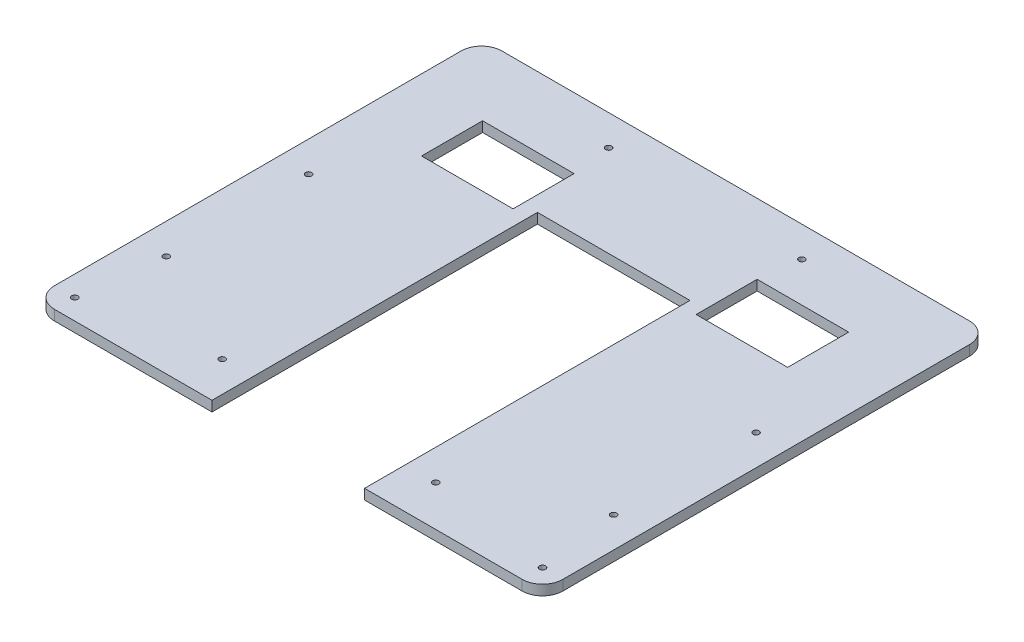
from build123d import *

# Parameters (mm, degrees)
EXTRUDE_1_DEPTH     = 5
SKETCH_4_W          = 45
SKETCH_4_H          = 30
CUT_EXTRUDE_3_DEPTH = 5
SKETCH_5_W          = 75
SKETCH_5_H          = 160
CUT_EXTRUDE_4_DEPTH = 5
CUT_EXTRUDE_5_REACH = 335.054
SKETCH_6_R          = 1.5
CUT_EXTRUDE_8_REACH = 335.054
SKETCH_8_R          = 1.5
CUT_EXTRUDE_9_REACH = 335.054
SKETCH_9_R          = 1.5


with BuildPart() as part:
    # 草图1 → 凸台-拉伸1 (new body)
    with BuildSketch(Plane(origin=(0, 0, 0), x_dir=(1, 0, 0), z_dir=(0, 1, 0))):
        with BuildLine():
            Line((10, 0), (240, 0))
            ThreePointArc((240, 0), (247.071067812, -2.928932188), (250, -10))
            Line((250, -10), (250, -210))
            ThreePointArc((250, -210), (247.071067812, -217.071067812), (240, -220))
            Line((240, -220), (10, -220))
            ThreePointArc((10, -220), (2.928932188, -217.071067812), (0, -210))
            Line((0, -210), (0, -10))
            ThreePointArc((0, -10), (2.928932188, -2.928932188), (10, 0))
        make_face()
    extrude(amount=EXTRUDE_1_DEPTH)

    # 草图4 → 切除-拉伸3 (cut)
    with BuildSketch(Plane.XZ):
        with Locations((192.5, 49.475)):
            Rectangle(SKETCH_4_W, SKETCH_4_H)
        with Locations((57.5, 49.475)):
            Rectangle(SKETCH_4_W, SKETCH_4_H)
    extrude(amount=-CUT_EXTRUDE_3_DEPTH, mode=Mode.SUBTRACT)

    # 草图5 → 切除-拉伸4 (cut)
    with BuildSketch(Plane.XZ):
        with Locations((125, 140)):
            Rectangle(SKETCH_5_W, SKETCH_5_H)
    extrude(amount=-CUT_EXTRUDE_4_DEPTH, mode=Mode.SUBTRACT)

    # 草图6 → 切除-拉伸5 (cut, up to next)
    with BuildSketch(Plane.XZ, mode=Mode.PRIVATE) as cut_extrude_5_sk1:
        with Locations(Location((72.5, 200, 0), (0, 0, 270))):
            Circle(SKETCH_6_R)
    cut_extrude_5_tool1 = extrude(cut_extrude_5_sk1.sketch, amount=-CUT_EXTRUDE_5_REACH, mode=Mode.PRIVATE) & part.part
    # 草图6 → 切除-拉伸5 (cut, up to next)
    with BuildSketch(Plane.XZ, mode=Mode.PRIVATE) as cut_extrude_5_sk2:
        with Locations(Location((177.5, 200, 0), (0, 0, 90))):
            Circle(SKETCH_6_R)
    cut_extrude_5_tool2 = extrude(cut_extrude_5_sk2.sketch, amount=-CUT_EXTRUDE_5_REACH, mode=Mode.PRIVATE) & part.part
    add(cut_extrude_5_tool1.solids().sort_by_distance((72.5, 0, 200))[0], mode=Mode.SUBTRACT)
    add(cut_extrude_5_tool2.solids().sort_by_distance((177.5, 0, 200))[0], mode=Mode.SUBTRACT)

    # 草图8 → 切除-拉伸8 (cut, up to next)
    with BuildSketch(Plane.XZ, mode=Mode.PRIVATE) as cut_extrude_8_sk1:
        with Locations(Location((235, 170, 0), (0, 0, 270))):
            Circle(SKETCH_8_R)
    cut_extrude_8_tool1 = extrude(cut_extrude_8_sk1.sketch, amount=-CUT_EXTRUDE_8_REACH, mode=Mode.PRIVATE) & part.part
    # 草图8 → 切除-拉伸8 (cut, up to next)
    with BuildSketch(Plane.XZ, mode=Mode.PRIVATE) as cut_extrude_8_sk2:
        with Locations(Location((235, 100, 0), (0, 0, 270))):
            Circle(SKETCH_8_R)
    cut_extrude_8_tool2 = extrude(cut_extrude_8_sk2.sketch, amount=-CUT_EXTRUDE_8_REACH, mode=Mode.PRIVATE) & part.part
    # 草图8 → 切除-拉伸8 (cut, up to next)
    with BuildSketch(Plane.XZ, mode=Mode.PRIVATE) as cut_extrude_8_sk3:
        with Locations(Location((15, 100, 0), (0, 0, 90))):
            Circle(SKETCH_8_R)
    cut_extrude_8_tool3 = extrude(cut_extrude_8_sk3.sketch, amount=-CUT_EXTRUDE_8_REACH, mode=Mode.PRIVATE) & part.part
    # 草图8 → 切除-拉伸8 (cut, up to next)
    with BuildSketch(Plane.XZ, mode=Mode.PRIVATE) as cut_extrude_8_sk4:
        with Locations(Location((15, 170, 0), (0, 0, 90))):
            Circle(SKETCH_8_R)
    cut_extrude_8_tool4 = extrude(cut_extrude_8_sk4.sketch, amount=-CUT_EXTRUDE_8_REACH, mode=Mode.PRIVATE) & part.part
    add(cut_extrude_8_tool1.solids().sort_by_distance((235, 0, 170))[0], mode=Mode.SUBTRACT)
    add(cut_extrude_8_tool2.solids().sort_by_distance((235, 0, 100))[0], mode=Mode.SUBTRACT)
    add(cut_extrude_8_tool3.solids().sort_by_distance((15, 0, 100))[0], mode=Mode.SUBTRACT)
    add(cut_extrude_8_tool4.solids().sort_by_distance((15, 0, 170))[0], mode=Mode.SUBTRACT)

    # 草图9 → 切除-拉伸9 (cut, up to next)
    with BuildSketch(Plane.XZ, mode=Mode.PRIVATE) as cut_extrude_9_sk1:
        with Locations(Location((77.5, 15, 0), (0, 0, 270))):
            Circle(SKETCH_9_R)
    cut_extrude_9_tool1 = extrude(cut_extrude_9_sk1.sketch, amount=-CUT_EXTRUDE_9_REACH, mode=Mode.PRIVATE) & part.part
    # 草图9 → 切除-拉伸9 (cut, up to next)
    with BuildSketch(Plane.XZ, mode=Mode.PRIVATE) as cut_extrude_9_sk2:
        with Locations(Location((10, 210, 0), (0, 0, 270))):
            Circle(SKETCH_9_R)
    cut_extrude_9_tool2 = extrude(cut_extrude_9_sk2.sketch, amount=-CUT_EXTRUDE_9_REACH, mode=Mode.PRIVATE) & part.part
    # 草图9 → 切除-拉伸9 (cut, up to next)
    with BuildSketch(Plane.XZ, mode=Mode.PRIVATE) as cut_extrude_9_sk3:
        with Locations(Location((240, 210, 0), (0, 0, 90))):
            Circle(SKETCH_9_R)
    cut_extrude_9_tool3 = extrude(cut_extrude_9_sk3.sketch, amount=-CUT_EXTRUDE_9_REACH, mode=Mode.PRIVATE) & part.part
    # 草图9 → 切除-拉伸9 (cut, up to next)
    with BuildSketch(Plane.XZ, mode=Mode.PRIVATE) as cut_extrude_9_sk4:
        with Locations(Location((172.5, 15, 0), (0, 0, 90))):
            Circle(SKETCH_9_R)
    cut_extrude_9_tool4 = extrude(cut_extrude_9_sk4.sketch, amount=-CUT_EXTRUDE_9_REACH, mode=Mode.PRIVATE) & part.part
    add(cut_extrude_9_tool1.solids().sort_by_distance((77.5, 0, 15))[0], mode=Mode.SUBTRACT)
    add(cut_extrude_9_tool2.solids().sort_by_distance((10, 0, 210))[0], mode=Mode.SUBTRACT)
    add(cut_extrude_9_tool3.solids().sort_by_distance((240, 0, 210))[0], mode=Mode.SUBTRACT)
    add(cut_extrude_9_tool4.solids().sort_by_distance((172.5, 0, 15))[0], mode=Mode.SUBTRACT)


solid = part.part
